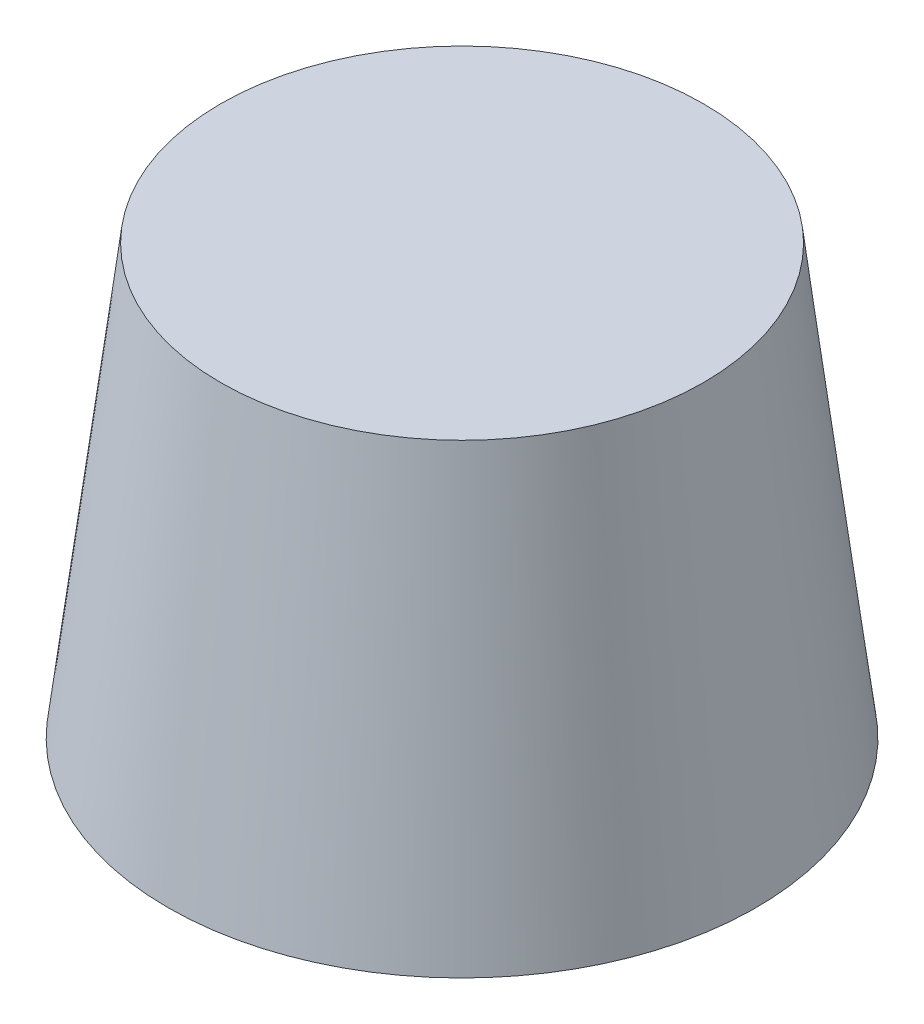
from build123d import *

# Parameters (mm, degrees)
SKETCH1_R                     = 7.9375
BOSS_EXTRUDE1_DEPTH           = 6.35
BOSS_EXTRUDE1_TAPER           = 7
BOSS_EXTRUDE1_OTHER_WAY_DEPTH = 6.35
BOSS_EXTRUDE1_OTHER_WAY_TAPER = -7


with BuildPart() as part:
    # Sketch1 → Boss-Extrude1 (new body)
    with BuildSketch(Plane(origin=(0, 0, 0), x_dir=(1, 0, 0), z_dir=(0, 1, 0))):
        Circle(SKETCH1_R)
    extrude(amount=BOSS_EXTRUDE1_DEPTH, taper=BOSS_EXTRUDE1_TAPER)

    # Sketch1 → Boss-Extrude1 other way (add)
    with BuildSketch(Plane(origin=(0, 0, 0), x_dir=(1, 0, 0), z_dir=(0, 1, 0))):
        Circle(SKETCH1_R)
    extrude(amount=-BOSS_EXTRUDE1_OTHER_WAY_DEPTH, taper=BOSS_EXTRUDE1_OTHER_WAY_TAPER)


solid = part.part
